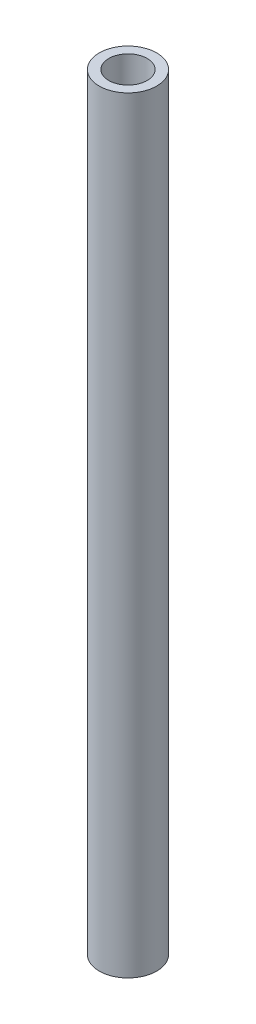
from build123d import *

# Parameters (mm, degrees)
SKETCH1_R           = 4.7625
SKETCH1_R_2         = 3.175
BOSS_EXTRUDE1_DEPTH = 127


with BuildPart() as part:
    # Sketch1 → Boss-Extrude1 (new body)
    with BuildSketch(Plane(origin=(0, 0, 0), x_dir=(1, 0, 0), z_dir=(0, 1, 0))):
        with Locations(Location((0, 0, 0), (0, 0, 270))):
            Circle(SKETCH1_R)
        with Locations(Location((0, 0, 0), (0, 0, 270))):
            Circle(SKETCH1_R_2, mode=Mode.SUBTRACT)
    extrude(amount=BOSS_EXTRUDE1_DEPTH)


solid = part.part
